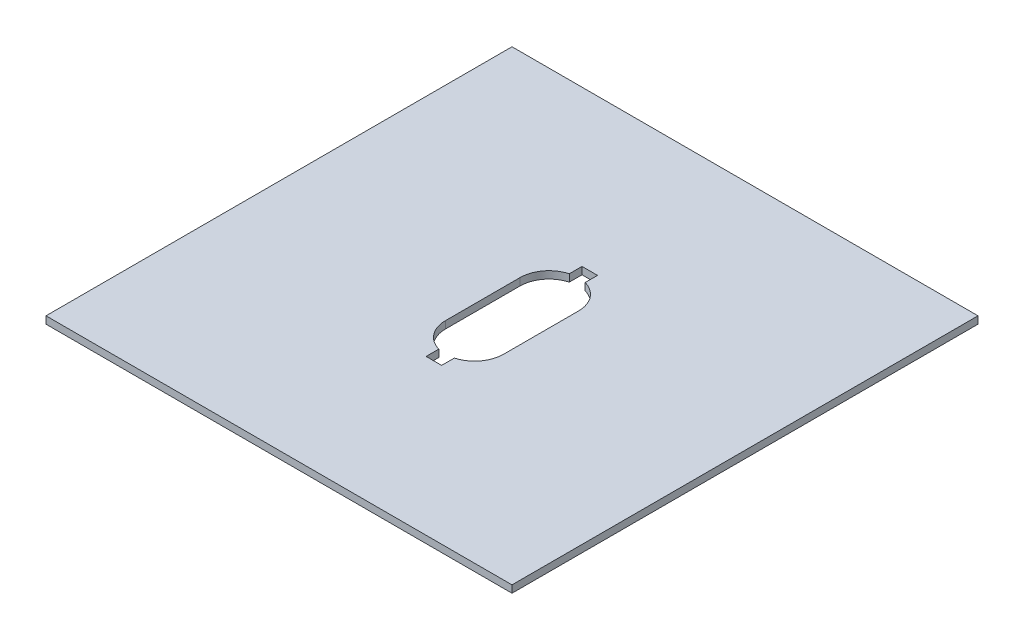
from build123d import *

# Parameters (mm, degrees)
ESQUISSE1_W             = 304.8
ESQUISSE1_H             = 304.8
BOSS_EXTRU_1_DEPTH      = 2.38125
ENL_V_MAT_EXTRU_1_DEPTH = 216.578759172


with BuildPart() as part:
    # Esquisse1 → Boss.-Extru.1 (new, symmetric)
    with BuildSketch(Plane(origin=(0, 0, 0), x_dir=(1, 0, 0), z_dir=(0, 1, 0))):
        Rectangle(ESQUISSE1_W, ESQUISSE1_H)
    extrude(amount=BOSS_EXTRU_1_DEPTH, both=True)

    # Esquisse2 → Enlèv. mat.-Extru.1 (cut, through all)
    with BuildSketch(Plane(origin=(0, 2.38125, 0), x_dir=(1, 0, 0), z_dir=(0, 1, 0))):
        with BuildLine():
            Line((-5.08, -51.10603291), (5.08, -51.10603291))
            Line((5.08, -51.10603291), (5.08, -42.795254256))
            ThreePointArc((5.08, -42.795254256), (15.142330949, -35.978603508), (19.0246, -24.46143291))
            Line((19.0246, -24.46143291), (19.0246, 24.46143291))
            ThreePointArc((19.0246, 24.46143291), (15.142330949, 35.978603508), (5.08, 42.795254256))
            Line((5.08, 42.795254256), (5.08, 50.87496709))
            Line((5.08, 50.87496709), (-5.08, 50.87496709))
            Line((-5.08, 50.87496709), (-5.08, 42.564188437))
            ThreePointArc((-5.08, 42.564188437), (-15.142330949, 35.747537688), (-19.0246, 24.23036709))
            Line((-19.0246, 24.23036709), (-19.0246, -24.46143291))
            ThreePointArc((-19.0246, -24.46143291), (-15.142330949, -35.978603508), (-5.08, -42.795254256))
            Line((-5.08, -42.795254256), (-5.08, -51.10603291))
        make_face()
    extrude(amount=-ENL_V_MAT_EXTRU_1_DEPTH, mode=Mode.SUBTRACT)


solid = part.part
